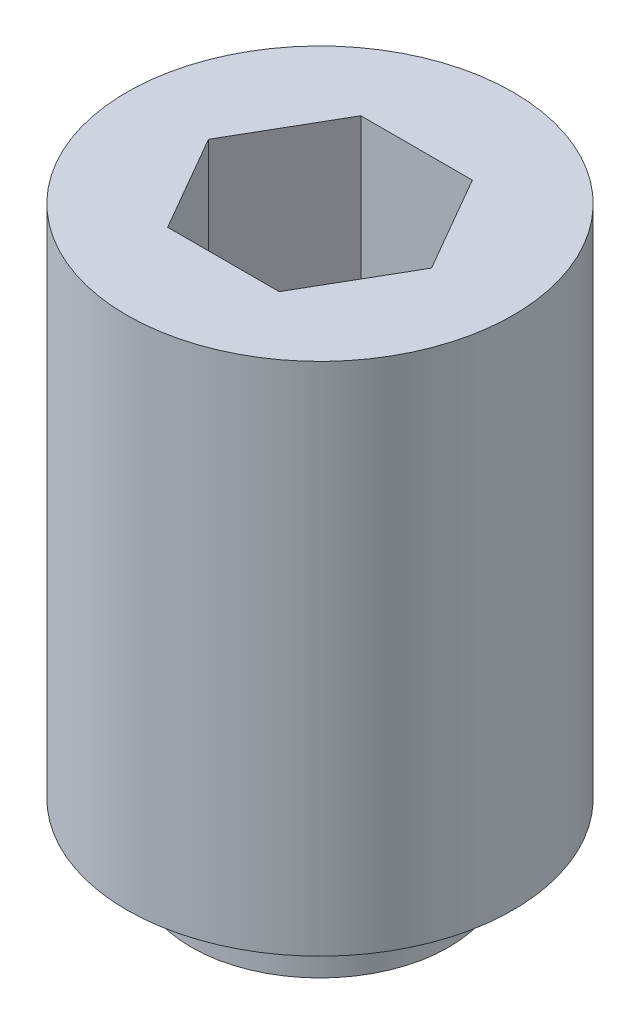
from build123d import *

# Parameters (mm, degrees)
SKETCH1_W           = 3
SKETCH1_H           = 8
SKETCH3_R           = 2
BOSS_EXTRUDE1_DEPTH = 1
CUT_EXTRUDE1_DEPTH  = 3.5


with BuildPart() as part:
    # Sketch1 → Revolve1 (revolve)
    with BuildSketch(Plane.XY, mode=Mode.PRIVATE) as revolve1_sk:
        with Locations((1.5, -4)):
            Rectangle(SKETCH1_W, SKETCH1_H)
    revolve(revolve1_sk.sketch.rotate(Axis((0, 61.691642626, 0), (0, -1, 0)), 90), axis=Axis((0, 61.691642626, 0), (0, -1, 0)))

    # Sketch2 → Cut-Extrude1 (cut)
    with BuildSketch(Plane(origin=(0, 0, 0), x_dir=(-1, 0, 0), z_dir=(0, 1, 0))):
        Polygon((-0.866025404, -1.5), (0.866025404, -1.5), (1.732050808, 0), (0.866025404, 1.5), (-0.866025404, 1.5), (-1.732050808, 0), align=None)
    extrude(amount=-CUT_EXTRUDE1_DEPTH, mode=Mode.SUBTRACT)


with BuildPart() as body_2:
    # Sketch3 → Boss-Extrude1 (new body)
    with BuildSketch(Plane.XZ.offset(8)):
        with Locations(Location((0, 0, 0), (0, 0, 270))):
            Circle(SKETCH3_R)
    extrude(amount=BOSS_EXTRUDE1_DEPTH)


solid = Compound([part.part, body_2.part])
